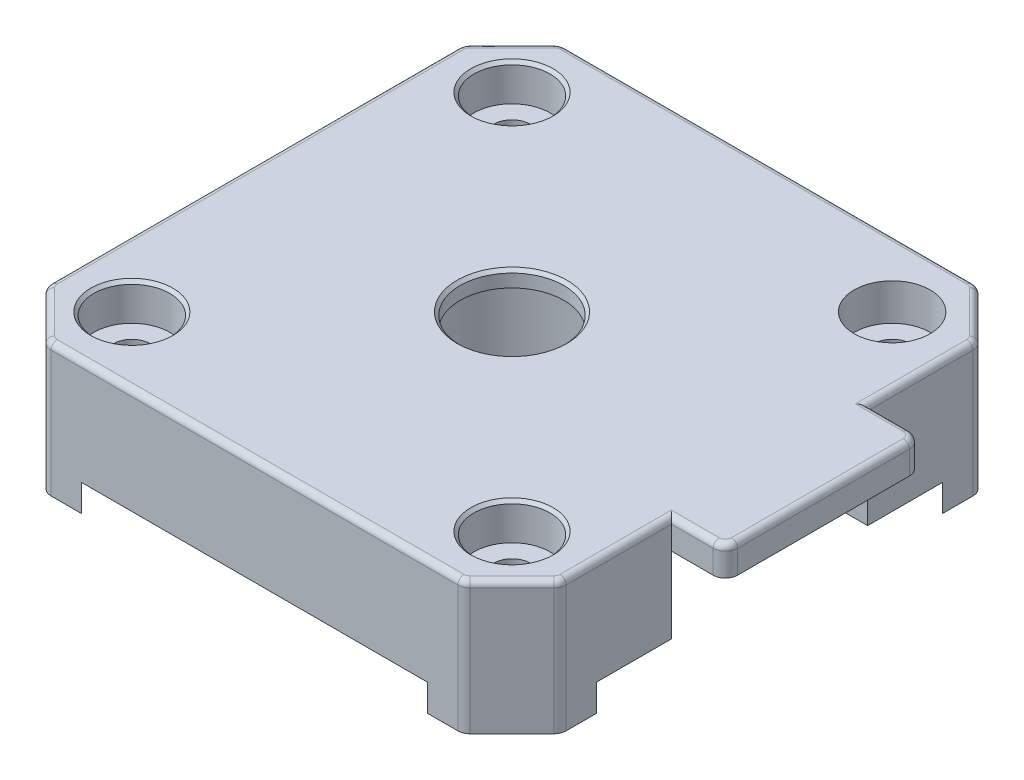
from build123d import *

# Parameters (mm, degrees)
SALIENTE_EXTRUIR1_DEPTH                              = 10.8
CORTAR_EXTRUIR1_DEPTH                                = 2.2
SALIENTE_EXTRUIR2_DEPTH                              = 2.2
SALIENTE_EXTRUIR3_DEPTH                              = 2.2
CROQUIS5_W                                           = 16
CROQUIS5_H                                           = 2.4
SALIENTE_EXTRUIR4_DEPTH                              = 4.4
CROQUIS6_W                                           = 16
CROQUIS6_H                                           = 6.2
CORTAR_EXTRUIR2_DEPTH                                = 21
REFRENTADO_PARA_PERNO_CON_CABEZA_HEXAGON_D           = 8.45
REFRENTADO_PARA_PERNO_CON_CABEZA_HEXAGON_CBORE_D     = 15
REFRENTADO_PARA_PERNO_CON_CABEZA_HEXAGON_CBORE_DEPTH = 7.3
REFRENTADO_PARA_TORNILLO_CON_CABEZA_HEXA_D           = 3
REFRENTADO_PARA_TORNILLO_CON_CABEZA_HEXA_DEPTH       = 10.8
REFRENTADO_PARA_TORNILLO_CON_CABEZA_HEXA_CBORE_D     = 6.2
REFRENTADO_PARA_TORNILLO_CON_CABEZA_HEXA_CBORE_DEPTH = 3
REDONDEO1_R                                          = 1
CHAFL_N1_SIZE                                        = 0.25
REDONDEO2_R                                          = 0.5


with BuildPart() as part:
    # Croquis1 → Saliente-Extruir1 (new body)
    with BuildSketch(Plane(origin=(0, 0, 0), x_dir=(1, 0, 0), z_dir=(0, 1, 0))):
        Polygon((21, -17), (21, 17), (17, 21), (-17, 21), (-21, 17), (-21, -17), (-17, -21), (17, -21), align=None)
    extrude(amount=-SALIENTE_EXTRUIR1_DEPTH)

    # Croquis2 → Cortar-Extruir1 (cut)
    with BuildSketch(Plane.XZ.offset(10.8)):
        Polygon((-21, 17), (-21, -14.100780618), (-14.100780618, -21), (14.100780618, -21), (21, -14.100780618), (21, 17), (17, 21), (-17, 21), align=None)
    extrude(amount=-CORTAR_EXTRUIR1_DEPTH, mode=Mode.SUBTRACT)

    # Croquis3 → Saliente-Extruir2 (add)
    with BuildSketch(Plane.XZ.offset(8.6)):
        Polygon((-21, 17), (-17, 21), (-14.100780618, 21), (-21, 14.100780618), align=None)
    extrude(amount=SALIENTE_EXTRUIR2_DEPTH)

    # Croquis4 → Saliente-Extruir3 (add)
    with BuildSketch(Plane.XZ.offset(8.6)):
        Polygon((21, 17), (21, 14.100780618), (14.100780618, 21), (17, 21), align=None)
    extrude(amount=SALIENTE_EXTRUIR3_DEPTH)

    # Croquis5 → Saliente-Extruir4 (add)
    with BuildSketch(Plane(origin=(21, 0, 0), x_dir=(0, 0, -1), z_dir=(1, 0, 0))):
        with Locations((0, -1.2)):
            Rectangle(CROQUIS5_W, CROQUIS5_H)
    extrude(amount=SALIENTE_EXTRUIR4_DEPTH)

    # Croquis6 → Cortar-Extruir2 (cut)
    with BuildSketch(Plane(origin=(21, 0, 0), x_dir=(0, 0, -1), z_dir=(1, 0, 0))):
        with Locations((0, -5.5)):
            Rectangle(CROQUIS6_W, CROQUIS6_H)
    extrude(amount=-CORTAR_EXTRUIR2_DEPTH, mode=Mode.SUBTRACT)

    # Refrentado para perno con cabeza hexagonal de M81 (through all)
    with Locations(Plane(origin=(0, -8.6, 0), x_dir=(-1, 0, 0), z_dir=(0, -1, 0))):
        with Locations((0, 0)):
            CounterBoreHole(REFRENTADO_PARA_PERNO_CON_CABEZA_HEXAGON_D / 2, REFRENTADO_PARA_PERNO_CON_CABEZA_HEXAGON_CBORE_D / 2, REFRENTADO_PARA_PERNO_CON_CABEZA_HEXAGON_CBORE_DEPTH)

    # Refrentado para tornillo con cabeza hexagonal de M2.51
    with Locations(Plane(origin=(0, 0, 0), x_dir=(1, 0, 0), z_dir=(0, 1, 0))):
        with Locations((15.5, -15.5), (-15.5, -15.5), (-15.5, 15.5), (15.5, 15.5)):
            CounterBoreHole(REFRENTADO_PARA_TORNILLO_CON_CABEZA_HEXA_D / 2, REFRENTADO_PARA_TORNILLO_CON_CABEZA_HEXA_CBORE_D / 2, REFRENTADO_PARA_TORNILLO_CON_CABEZA_HEXA_CBORE_DEPTH, depth=REFRENTADO_PARA_TORNILLO_CON_CABEZA_HEXA_DEPTH)

    # Redondeo1
    redondeo1_edges = [part.edges().sort_by_distance(p)[0] for p in [
        (-21, -5.4, -17),
        (-17, -5.4, -21),
        (17, -5.4, -21),
        (21, -5.4, -17),
        (21, -5.4, 17),
        (-21, -5.4, 17),
        (-17, -5.4, 21),
        (17, -5.4, 21),
        (25.4, -1.2, -8),
        (25.4, -1.2, 8),
    ]]
    fillet(redondeo1_edges, radius=REDONDEO1_R)

    # Chaflán1
    chafl_n1_edges = [part.edges().sort_by_distance(p)[0] for p in [
        (-4.225, 0, 0),
        (-18.6, 0, -15.5),
        (-18.6, 0, 15.5),
        (12.4, 0, 15.5),
    ]]
    chamfer(chafl_n1_edges, length=CHAFL_N1_SIZE)

    # Redondeo2
    redondeo2_edges = [part.edges().sort_by_distance(p)[0] for p in [
        (25.4, 0, 0),
        (19, 0, 19),
        (21, 0, 12.292893219),
        (22.7, 0, 8),
        (22.7, 0, -8),
        (19, 0, -19),
        (0, 0, -21),
        (-19, 0, -19),
        (-21, 0, 0),
        (-19, 0, 19),
        (0, 0, 21),
        (20.923879533, 0, 16.96846987),
        (20.923879533, 0, -16.96846987),
        (-20.923879533, 0, -16.96846987),
        (16.96846987, 0, 20.923879533),
        (16.96846987, 0, -20.923879533),
        (-16.96846987, 0, 20.923879533),
        (-16.96846987, 0, -20.923879533),
        (25.107106781, 0, 7.707106781),
        (-20.923879533, 0, 16.96846987),
        (25.107106781, 0, -7.707106781),
        (21, 0, -12.292893219),
    ]]
    fillet(redondeo2_edges, radius=REDONDEO2_R)


solid = part.part
